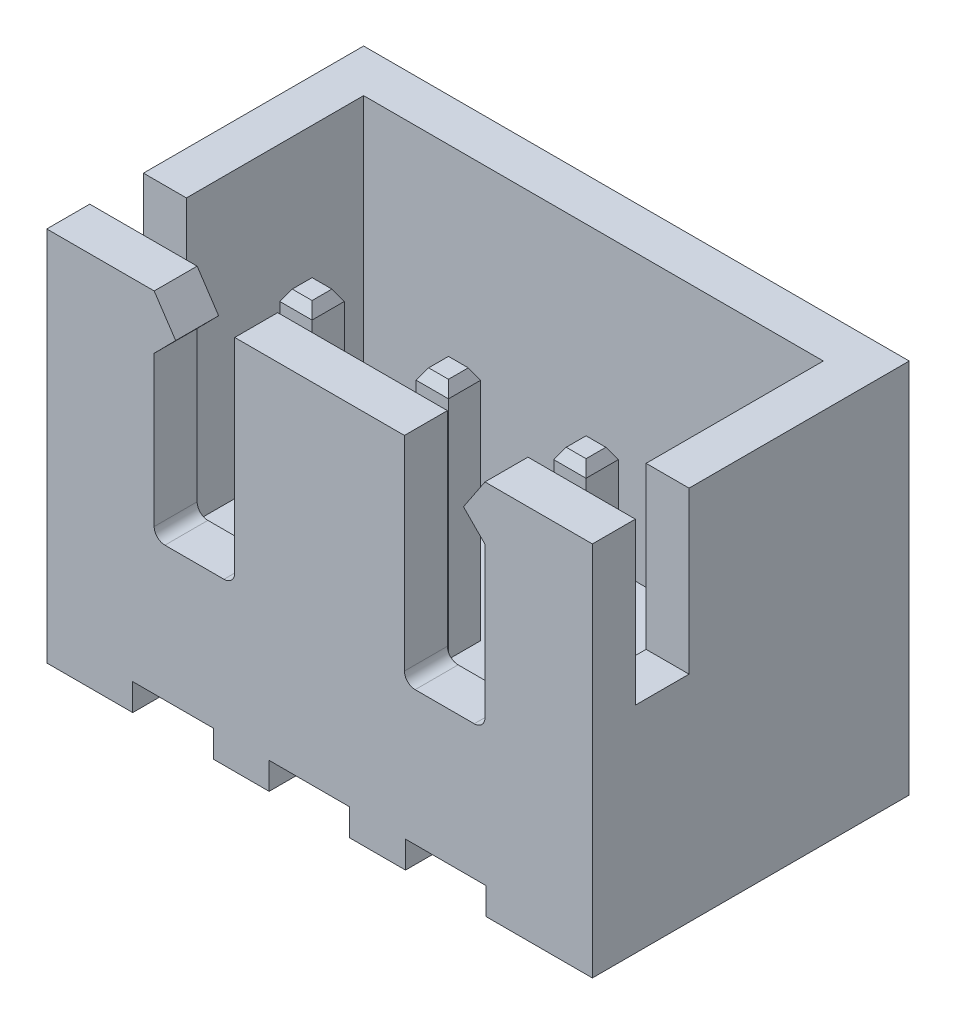
from build123d import *
from OCP.BRepFilletAPI import BRepFilletAPI_MakeChamfer

# Parameters (mm, degrees)
SKETCH2_W             = 10.16
SKETCH2_H             = 5.9
BOSS_EXTRUDE1_DEPTH   = 1.7
SKETCH3_W             = 10.16
SKETCH3_H             = 5.9
SKETCH3_W_2           = 8.56
SKETCH3_H_2           = 4.3
BOSS_EXTRUDE2_DEPTH   = 5.3
SKETCH4_W             = 0.6
SKETCH4_H             = 0.6
BOSS_EXTRUDE3_DEPTH   = 4.4
BOSS_EXTRUDE3_2_DEPTH = 4.4
BOSS_EXTRUDE3_3_DEPTH = 4.4
CHAMFER1_SIZE         = 0.2
CHAMFER1_SIZE2        = 0.115470054
CHAMFER2_SIZE         = 0.2
CHAMFER2_SIZE2        = 0.115470054
CHAMFER3_SIZE         = 0.2
CHAMFER3_SIZE2        = 0.115470054
SKETCH5_W             = 1
SKETCH5_H             = 3
CUT_EXTRUDE1_DEPTH    = 0.8
SKETCH6_W             = 1
SKETCH6_H             = 3
CUT_EXTRUDE2_DEPTH    = 3.3
CUT_EXTRUDE3_DEPTH    = 0.8
SKETCH8_W             = 1.5
SKETCH8_H             = 0.5
CUT_EXTRUDE4_DEPTH    = 6.3
SKETCH9_W             = 0.6
SKETCH9_H             = 0.6
BOSS_EXTRUDE4_DEPTH   = 0.7
BOSS_EXTRUDE4_2_DEPTH = 0.7
BOSS_EXTRUDE4_3_DEPTH = 0.7
SKETCH13_W            = 0.6
SKETCH13_H            = 0.6
BOSS_EXTRUDE5_DEPTH   = 3.2
FILLET1_R             = 0.6
CHAMFER4_SIZE         = 0.2
CHAMFER4_SIZE2        = 0.115470054
CHAMFER5_SIZE         = 0.2
CHAMFER5_SIZE2        = 0.115470054
CHAMFER6_SIZE         = 0.2
CHAMFER6_SIZE2        = 0.115470054
FILLET2_R             = 0.6
FILLET3_R             = 0.6


with BuildPart() as part:
    # Sketch2 → Boss-Extrude1 (new body)
    with BuildSketch(Plane(origin=(0, 0, 0), x_dir=(1, 0, 0), z_dir=(0, 1, 0))):
        Rectangle(SKETCH2_W, SKETCH2_H)
    extrude(amount=BOSS_EXTRUDE1_DEPTH)

    # Sketch3 → Boss-Extrude2 (add)
    with BuildSketch(Plane(origin=(0, 1.7, 0), x_dir=(1, 0, 0), z_dir=(0, 1, 0))):
        Rectangle(SKETCH3_W, SKETCH3_H)
        Rectangle(SKETCH3_W_2, SKETCH3_H_2, mode=Mode.SUBTRACT)
    extrude(amount=BOSS_EXTRUDE2_DEPTH)

    # Sketch5 → Cut-Extrude1 (cut)
    with BuildSketch(Plane(origin=(5.08, 0, 0), x_dir=(0, 0, -1), z_dir=(1, 0, 0))):
        with Locations((-1.65, 5.5)):
            Rectangle(SKETCH5_W, SKETCH5_H)
    extrude(amount=-CUT_EXTRUDE1_DEPTH, mode=Mode.SUBTRACT)

    # Sketch6 → Cut-Extrude2 (cut)
    with BuildSketch(Plane(origin=(-4.28, 0, 0), x_dir=(0, 0, -1), z_dir=(1, 0, 0))):
        with Locations((-1.65, 5.5)):
            Rectangle(SKETCH6_W, SKETCH6_H)
    extrude(amount=-CUT_EXTRUDE2_DEPTH, mode=Mode.SUBTRACT)

    # Sketch7 → Cut-Extrude3 (cut)
    with BuildSketch(Plane.XY.offset(2.95)):
        with BuildLine():
            Line((-3.08, 7), (-2.68, 6.4))
            Line((-2.68, 6.4), (-3.08, 5.994767126))
            Line((-3.08, 5.994767126), (-3.08, 3.2))
            ThreePointArc((-3.08, 3.2), (-3.021421356, 3.058578644), (-2.88, 3))
            Line((-2.88, 3), (-1.78, 3))
            ThreePointArc((-1.78, 3), (-1.638578644, 3.058578644), (-1.58, 3.2))
            Line((-1.58, 3.2), (-1.58, 7))
            Line((-1.58, 7), (-3.08, 7))
        make_face()
        with BuildLine():
            Line((1.58, 7), (3.08, 7))
            Line((3.08, 7), (2.68, 6.4))
            Line((2.68, 6.4), (3.08, 5.994767126))
            Line((3.08, 5.994767126), (3.08, 3.2))
            ThreePointArc((3.08, 3.2), (3.021421356, 3.058578644), (2.88, 3))
            Line((2.88, 3), (1.78, 3))
            ThreePointArc((1.78, 3), (1.638578644, 3.058578644), (1.58, 3.2))
            Line((1.58, 3.2), (1.58, 7))
        make_face()
    extrude(amount=-CUT_EXTRUDE3_DEPTH, mode=Mode.SUBTRACT)

    # Sketch8 → Cut-Extrude4 (cut)
    with BuildSketch(Plane(origin=(0, 0, -2.95), x_dir=(-1, 0, 0), z_dir=(0, 0, -1))):
        with Locations((0.189333309, 0.25)):
            Rectangle(SKETCH8_W, SKETCH8_H)
        with Locations((2.729333309, 0.25)):
            Rectangle(SKETCH8_W, SKETCH8_H)
        with Locations((-2.350666691, 0.25)):
            Rectangle(SKETCH8_W, SKETCH8_H)
    extrude(amount=-CUT_EXTRUDE4_DEPTH, mode=Mode.SUBTRACT)


with BuildPart() as body_2:
    # Sketch4 → Boss-Extrude3 (new body)
    with BuildSketch(Plane(origin=(0, 1.7, 0), x_dir=(1, 0, 0), z_dir=(0, 1, 0))):
        with Locations((0, -0.55)):
            Rectangle(SKETCH4_W, SKETCH4_H)
    extrude(amount=BOSS_EXTRUDE3_DEPTH)

    # Chamfer2: one chamfer whose edges measure the first distance from different faces: ONE call of the kernel's chamfer builder (chamfer() names one face for all edges)
    chamfer2_edges_1 = [body_2.edges().sort_by_distance(p)[0] for p in [
        (-0.3, 6.1, 0.55),
    ]]
    chamfer2_side_1 = [body_2.faces().sort_by_distance(p)[0] for p in [
        (-0.3, 3.9, 0.55),
    ]]
    chamfer2_edges_2 = [body_2.edges().sort_by_distance(p)[0] for p in [
        (0, 6.1, 0.85),
    ]]
    chamfer2_side_2 = [body_2.faces().sort_by_distance(p)[0] for p in [
        (0, 3.9, 0.85),
    ]]
    chamfer2_edges_3 = [body_2.edges().sort_by_distance(p)[0] for p in [
        (0.3, 6.1, 0.55),
    ]]
    chamfer2_side_3 = [body_2.faces().sort_by_distance(p)[0] for p in [
        (0.3, 3.9, 0.55),
    ]]
    chamfer2_edges_4 = [body_2.edges().sort_by_distance(p)[0] for p in [
        (0, 6.1, 0.25),
    ]]
    chamfer2_side_4 = [body_2.faces().sort_by_distance(p)[0] for p in [
        (0, 3.9, 0.25),
    ]]
    chamfer2 = BRepFilletAPI_MakeChamfer(body_2.part.solid().wrapped)
    for e in chamfer2_edges_1:
        chamfer2.Add(CHAMFER2_SIZE, CHAMFER2_SIZE2, e.wrapped, chamfer2_side_1[0].wrapped)  # the first distance lies on this face
    for e in chamfer2_edges_2:
        chamfer2.Add(CHAMFER2_SIZE, CHAMFER2_SIZE2, e.wrapped, chamfer2_side_2[0].wrapped)  # the first distance lies on this face
    for e in chamfer2_edges_3:
        chamfer2.Add(CHAMFER2_SIZE, CHAMFER2_SIZE2, e.wrapped, chamfer2_side_3[0].wrapped)  # the first distance lies on this face
    for e in chamfer2_edges_4:
        chamfer2.Add(CHAMFER2_SIZE, CHAMFER2_SIZE2, e.wrapped, chamfer2_side_4[0].wrapped)  # the first distance lies on this face
    add(Compound.cast(chamfer2.Shape()), mode=Mode.REPLACE)


with BuildPart() as body_3:
    # Sketch4 → Boss-Extrude3 2 (new body)
    with BuildSketch(Plane(origin=(0, 1.7, 0), x_dir=(1, 0, 0), z_dir=(0, 1, 0))):
        with Locations((2.561655677, -0.55)):
            Rectangle(SKETCH4_W, SKETCH4_H)
    extrude(amount=BOSS_EXTRUDE3_2_DEPTH)

    # Chamfer3: one chamfer whose edges measure the first distance from different faces: ONE call of the kernel's chamfer builder (chamfer() names one face for all edges)
    chamfer3_edges_1 = [body_3.edges().sort_by_distance(p)[0] for p in [
        (2.261655677, 6.1, 0.55),
    ]]
    chamfer3_side_1 = [body_3.faces().sort_by_distance(p)[0] for p in [
        (2.261655677, 3.9, 0.55),
    ]]
    chamfer3_edges_2 = [body_3.edges().sort_by_distance(p)[0] for p in [
        (2.561655677, 6.1, 0.85),
    ]]
    chamfer3_side_2 = [body_3.faces().sort_by_distance(p)[0] for p in [
        (2.561655677, 3.9, 0.85),
    ]]
    chamfer3_edges_3 = [body_3.edges().sort_by_distance(p)[0] for p in [
        (2.861655677, 6.1, 0.55),
    ]]
    chamfer3_side_3 = [body_3.faces().sort_by_distance(p)[0] for p in [
        (2.861655677, 3.9, 0.55),
    ]]
    chamfer3_edges_4 = [body_3.edges().sort_by_distance(p)[0] for p in [
        (2.561655677, 6.1, 0.25),
    ]]
    chamfer3_side_4 = [body_3.faces().sort_by_distance(p)[0] for p in [
        (2.561655677, 3.9, 0.25),
    ]]
    chamfer3 = BRepFilletAPI_MakeChamfer(body_3.part.solid().wrapped)
    for e in chamfer3_edges_1:
        chamfer3.Add(CHAMFER3_SIZE, CHAMFER3_SIZE2, e.wrapped, chamfer3_side_1[0].wrapped)  # the first distance lies on this face
    for e in chamfer3_edges_2:
        chamfer3.Add(CHAMFER3_SIZE, CHAMFER3_SIZE2, e.wrapped, chamfer3_side_2[0].wrapped)  # the first distance lies on this face
    for e in chamfer3_edges_3:
        chamfer3.Add(CHAMFER3_SIZE, CHAMFER3_SIZE2, e.wrapped, chamfer3_side_3[0].wrapped)  # the first distance lies on this face
    for e in chamfer3_edges_4:
        chamfer3.Add(CHAMFER3_SIZE, CHAMFER3_SIZE2, e.wrapped, chamfer3_side_4[0].wrapped)  # the first distance lies on this face
    add(Compound.cast(chamfer3.Shape()), mode=Mode.REPLACE)


with BuildPart() as body_4:
    # Sketch4 → Boss-Extrude3 3 (new body)
    with BuildSketch(Plane(origin=(0, 1.7, 0), x_dir=(1, 0, 0), z_dir=(0, 1, 0))):
        with Locations((-2.54, -0.55)):
            Rectangle(SKETCH4_W, SKETCH4_H)
    extrude(amount=BOSS_EXTRUDE3_3_DEPTH)

    # Chamfer1: one chamfer whose edges measure the first distance from different faces: ONE call of the kernel's chamfer builder (chamfer() names one face for all edges)
    chamfer1_edges_1 = [body_4.edges().sort_by_distance(p)[0] for p in [
        (-2.84, 6.1, 0.55),
    ]]
    chamfer1_side_1 = [body_4.faces().sort_by_distance(p)[0] for p in [
        (-2.84, 3.9, 0.55),
    ]]
    chamfer1_edges_2 = [body_4.edges().sort_by_distance(p)[0] for p in [
        (-2.54, 6.1, 0.85),
    ]]
    chamfer1_side_2 = [body_4.faces().sort_by_distance(p)[0] for p in [
        (-2.54, 3.9, 0.85),
    ]]
    chamfer1_edges_3 = [body_4.edges().sort_by_distance(p)[0] for p in [
        (-2.24, 6.1, 0.55),
    ]]
    chamfer1_side_3 = [body_4.faces().sort_by_distance(p)[0] for p in [
        (-2.24, 3.9, 0.55),
    ]]
    chamfer1_edges_4 = [body_4.edges().sort_by_distance(p)[0] for p in [
        (-2.54, 6.1, 0.25),
    ]]
    chamfer1_side_4 = [body_4.faces().sort_by_distance(p)[0] for p in [
        (-2.54, 3.9, 0.25),
    ]]
    chamfer1 = BRepFilletAPI_MakeChamfer(body_4.part.solid().wrapped)
    for e in chamfer1_edges_1:
        chamfer1.Add(CHAMFER1_SIZE, CHAMFER1_SIZE2, e.wrapped, chamfer1_side_1[0].wrapped)  # the first distance lies on this face
    for e in chamfer1_edges_2:
        chamfer1.Add(CHAMFER1_SIZE, CHAMFER1_SIZE2, e.wrapped, chamfer1_side_2[0].wrapped)  # the first distance lies on this face
    for e in chamfer1_edges_3:
        chamfer1.Add(CHAMFER1_SIZE, CHAMFER1_SIZE2, e.wrapped, chamfer1_side_3[0].wrapped)  # the first distance lies on this face
    for e in chamfer1_edges_4:
        chamfer1.Add(CHAMFER1_SIZE, CHAMFER1_SIZE2, e.wrapped, chamfer1_side_4[0].wrapped)  # the first distance lies on this face
    add(Compound.cast(chamfer1.Shape()), mode=Mode.REPLACE)


with BuildPart() as body_5:
    # Sketch9 → Boss-Extrude4 (new body)
    with BuildSketch(Plane.XZ.offset(-0.5)):
        with Locations((-2.54, 0.55)):
            Rectangle(SKETCH9_W, SKETCH9_H)
    extrude(amount=BOSS_EXTRUDE4_DEPTH)



with BuildPart() as body_6:
    # Sketch9 → Boss-Extrude4 2 (new body)
    with BuildSketch(Plane.XZ.offset(-0.5)):
        with Locations((0, 0.55)):
            Rectangle(SKETCH9_W, SKETCH9_H)
    extrude(amount=BOSS_EXTRUDE4_2_DEPTH)


with BuildPart() as body_7:
    # Sketch9 → Boss-Extrude4 3 (new body)
    with BuildSketch(Plane.XZ.offset(-0.5)):
        with Locations((2.561655677, 0.55)):
            Rectangle(SKETCH9_W, SKETCH9_H)
    extrude(amount=BOSS_EXTRUDE4_3_DEPTH)


with BuildPart() as body_5_1:
    add(body_5.part)

    add(body_6.part)  # Boss-Extrude5 merges body 6

    add(body_7.part)  # Boss-Extrude5 merges body 7
    # Sketch13 → Boss-Extrude5 (add)
    with BuildSketch(Plane(origin=(0, 0, 0.25), x_dir=(-1, 0, 0), z_dir=(0, 0, -1))):
        with Locations((-2.561655677, 0.1)):
            Rectangle(SKETCH13_W, SKETCH13_H)
        with Locations((0, 0.1)):
            Rectangle(SKETCH13_W, SKETCH13_H)
        with Locations((2.54, 0.1)):
            Rectangle(SKETCH13_W, SKETCH13_H)
    extrude(amount=BOSS_EXTRUDE5_DEPTH)

    # Fillet1
    fillet1_edges = [body_5_1.edges().sort_by_distance(p)[0] for p in [
        (2.561655677, -0.2, 0.85),
    ]]
    fillet(fillet1_edges, radius=FILLET1_R)

    # Chamfer4
    chamfer4_edges = [body_5_1.edges().sort_by_distance(p)[0] for p in [
        (2.561655677, 0.4, -2.95),
        (2.261655677, 0.1, -2.95),
        (2.561655677, -0.2, -2.95),
        (2.861655677, 0.1, -2.95),
    ]]
    chamfer4_side = [body_5_1.faces().sort_by_distance(p)[0] for p in [
        (2.561655677, 0.1, -2.95),
    ]]
    chamfer(chamfer4_edges, length=CHAMFER4_SIZE, length2=CHAMFER4_SIZE2, reference=chamfer4_side[0])

    # Chamfer5
    chamfer5_edges = [body_5_1.edges().sort_by_distance(p)[0] for p in [
        (0, 0.4, -2.95),
        (-0.3, 0.1, -2.95),
        (0, -0.2, -2.95),
        (0.3, 0.1, -2.95),
    ]]
    chamfer5_side = [body_5_1.faces().sort_by_distance(p)[0] for p in [
        (0, 0.1, -2.95),
    ]]
    chamfer(chamfer5_edges, length=CHAMFER5_SIZE, length2=CHAMFER5_SIZE2, reference=chamfer5_side[0])

    # Chamfer6
    chamfer6_edges = [body_5_1.edges().sort_by_distance(p)[0] for p in [
        (-2.54, 0.4, -2.95),
        (-2.84, 0.1, -2.95),
        (-2.54, -0.2, -2.95),
        (-2.24, 0.1, -2.95),
    ]]
    chamfer6_side = [body_5_1.faces().sort_by_distance(p)[0] for p in [
        (-2.54, 0.1, -2.95),
    ]]
    chamfer(chamfer6_edges, length=CHAMFER6_SIZE, length2=CHAMFER6_SIZE2, reference=chamfer6_side[0])

    # Fillet2
    fillet2_edges = [body_5_1.edges().sort_by_distance(p)[0] for p in [
        (0, -0.2, 0.85),
    ]]
    fillet(fillet2_edges, radius=FILLET2_R)

    # Fillet3
    fillet3_edges = [body_5_1.edges().sort_by_distance(p)[0] for p in [
        (-2.54, -0.2, 0.85),
    ]]
    fillet(fillet3_edges, radius=FILLET3_R)


solid = Compound([part.part, body_2.part, body_3.part, body_4.part, body_5_1.part])
